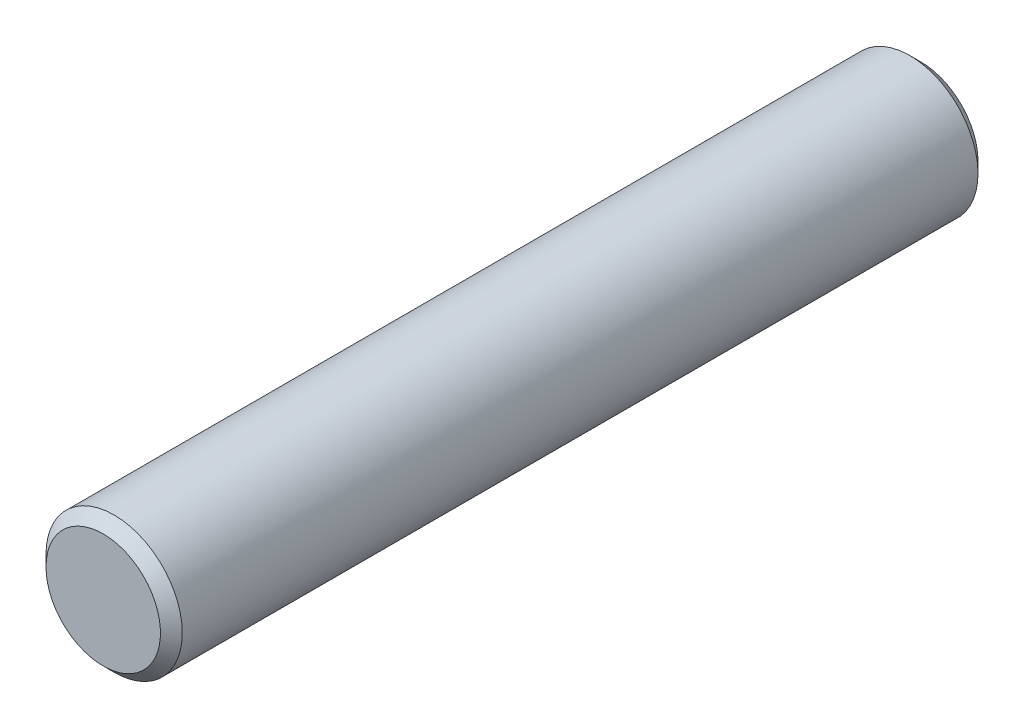
from build123d import *

# Parameters (mm, degrees)
SKETCH1_W     = 30
SKETCH1_H     = 2.5
CHAMFER1_SIZE = 0.4


with BuildPart() as part:
    # Sketch1 → Revolve1 (revolve)
    with BuildSketch(Plane(origin=(0, 0, 0), x_dir=(0, 0, -1), z_dir=(1, 0, 0)), mode=Mode.PRIVATE) as revolve1_sk:
        with Locations((0, 1.25)):
            Rectangle(SKETCH1_W, SKETCH1_H)
    revolve(revolve1_sk.sketch.rotate(Axis((0, 0, 12.361495845), (0, 0, -1)), 90), axis=Axis((0, 0, 12.361495845), (0, 0, -1)))

    # Chamfer1
    chamfer1_edges = [part.edges().sort_by_distance(p)[0] for p in [
        (-2.5, 0, 15),
        (-2.5, 0, -15),
    ]]
    chamfer(chamfer1_edges, length=CHAMFER1_SIZE)


solid = part.part
